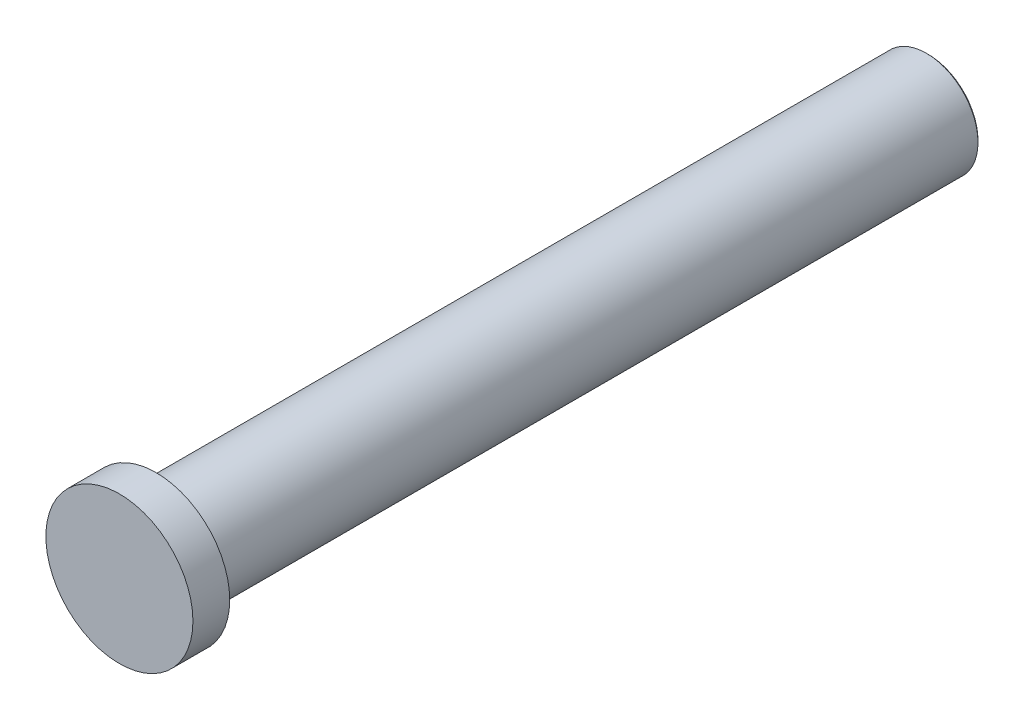
from build123d import *

# Parameters (mm, degrees)
SKETCH2_R           = 1.4
BOSS_EXTRUDE1_DEPTH = 21
CHAMFER2_SIZE       = 0.05
SKETCH3_R           = 2
BOSS_EXTRUDE2_DEPTH = 1


with BuildPart() as part:
    # Sketch2 → Boss-Extrude1 (new body)
    with BuildSketch(Plane.XY):
        with Locations(Location((0, 0, 0), (0, 0, 180))):
            Circle(SKETCH2_R)
    extrude(amount=BOSS_EXTRUDE1_DEPTH)

    # Chamfer2
    chamfer2_edges = [part.edges().sort_by_distance(p)[0] for p in [
        (1.4, 0, 0),
        (1.4, 0, 21),
    ]]
    chamfer(chamfer2_edges, length=CHAMFER2_SIZE)

    # Sketch3 → Boss-Extrude2 (add)
    with BuildSketch(Plane.XY.offset(21)):
        Circle(SKETCH3_R)
    extrude(amount=BOSS_EXTRUDE2_DEPTH)


solid = part.part
